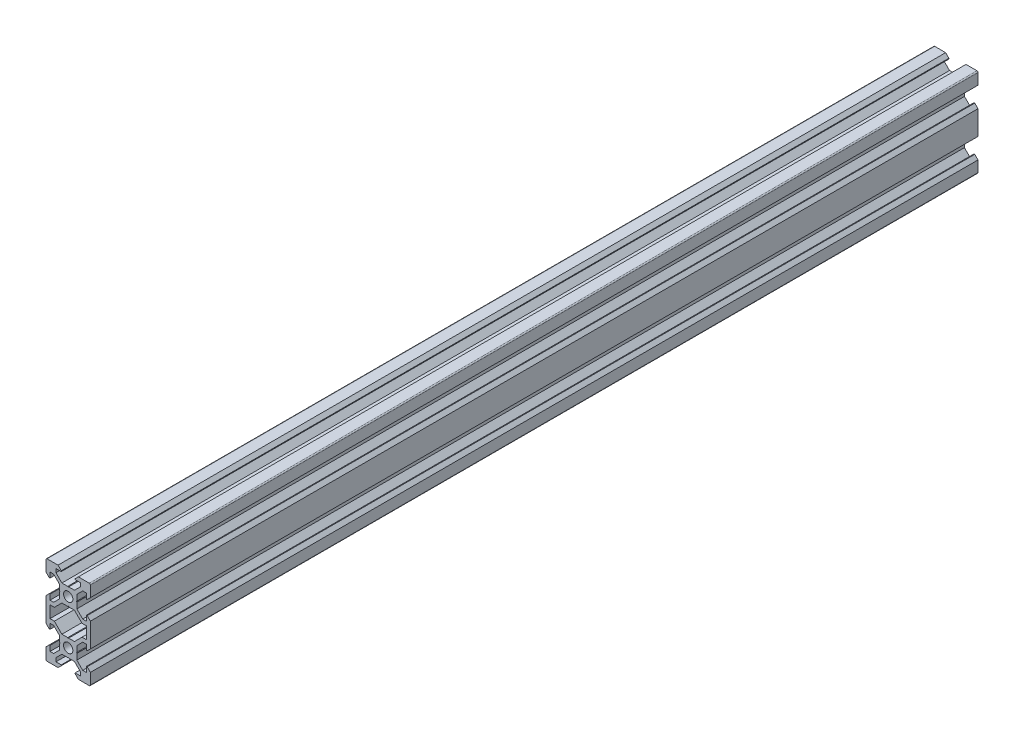
from build123d import *
from build123d.topology import SkipClean

# Parameters (mm, degrees)
BOSS_EXTRU_1_DEPTH     = 400
SYM_TRIE6_COPY_1_DEPTH = 400


with BuildPart() as part:
    # Esquisse1 → Boss.-Extru.1 (new body)
    with BuildSketch(Plane.XY):
        with BuildLine():
            Line((-9.5, 10), (-4.58, 10))
            Line((-4.58, 10), (-3.125, 8.545))
            Line((-3.125, 8.545), (-3.125, 8.2))
            Line((-3.125, 8.2), (-5.5, 8.2))
            Line((-5.5, 8.2), (-5.5, 6.560660172))
            Line((-5.5, 6.560660172), (-2.839339828, 3.9))
            Line((-2.839339828, 3.9), (-0.21, 3.9))
            Line((-0.21, 3.9), (0, 3.69))
            Line((0, 3.69), (0, 2.1))
            ThreePointArc((0, 2.1), (-2.1, 0), (0, -2.1))
            Line((0, -2.1), (0, -3.69))
            Line((0, -3.69), (-0.21, -3.9))
            Line((-0.21, -3.9), (-2.839339828, -3.9))
            Line((-2.839339828, -3.9), (-6.239339828, -7.3))
            Line((-6.239339828, -7.3), (-8.2, -7.3))
            Line((-8.2, -7.3), (-8.2, -10))
            Line((-8.2, -10), (-10, -10))
            Line((-10, -10), (-10, -4.58))
            Line((-10, -4.58), (-8.545, -3.125))
            Line((-8.545, -3.125), (-8.2, -3.125))
            Line((-8.2, -3.125), (-8.2, -5.5))
            Line((-8.2, -5.5), (-6.560660172, -5.5))
            Line((-6.560660172, -5.5), (-3.9, -2.839339828))
            Line((-3.9, -2.839339828), (-3.9, -0.21))
            Line((-3.9, -0.21), (-3.69, 0))
            Line((-3.69, 0), (-3.9, 0.21))
            Line((-3.9, 0.21), (-3.9, 2.839339828))
            Line((-3.9, 2.839339828), (-6.560660172, 5.5))
            Line((-6.560660172, 5.5), (-8.2, 5.5))
            Line((-8.2, 5.5), (-8.2, 3.125))
            Line((-8.2, 3.125), (-8.545, 3.125))
            Line((-8.545, 3.125), (-10, 4.58))
            Line((-10, 4.58), (-10, 9.5))
            ThreePointArc((-10, 9.5), (-9.853553391, 9.853553391), (-9.5, 10))
        make_face()
    boss_extru_1 = extrude(amount=BOSS_EXTRU_1_DEPTH)

    # Symétrie1: Boss.-Extru.1 across plane
    add(boss_extru_1.mirror(Plane(origin=(0, 3.69, 400), x_dir=(0, 0, 1), z_dir=(-1, 0, 0))))

    # Symétrie6: Boss.-Extru.1 across plane
    add(boss_extru_1.mirror(Plane(origin=(-8.2, -10, 400), x_dir=(0, 0, 1), z_dir=(0, 1, 0))))

    # Symétrie6 copy 1 sketch → Symétrie6 copy 1 (add)
    with SkipClean():  # the faces are left unmerged after this step: merging them gives an invalid solid
        with BuildSketch(Plane(origin=(0, -20, 0), x_dir=(-1, 0, 0), z_dir=(0, 0, 1))):
            with BuildLine():
                Line((-9.5, 10), (-4.58, 10))
                Line((-4.58, 10), (-3.125, 8.545))
                Line((-3.125, 8.545), (-3.125, 8.2))
                Line((-3.125, 8.2), (-5.5, 8.2))
                Line((-5.5, 8.2), (-5.5, 6.560660172))
                Line((-5.5, 6.560660172), (-2.839339828, 3.9))
                Line((-2.839339828, 3.9), (-0.21, 3.9))
                Line((-0.21, 3.9), (0, 3.69))
                Line((0, 3.69), (0, 2.1))
                ThreePointArc((0, 2.1), (-2.1, 0), (0, -2.1))
                Line((0, -2.1), (0, -3.69))
                Line((0, -3.69), (-0.21, -3.9))
                Line((-0.21, -3.9), (-2.839339828, -3.9))
                Line((-2.839339828, -3.9), (-6.239339828, -7.3))
                Line((-6.239339828, -7.3), (-8.2, -7.3))
                Line((-8.2, -7.3), (-8.2, -10))
                Line((-8.2, -10), (-10, -10))
                Line((-10, -10), (-10, -4.58))
                Line((-10, -4.58), (-8.545, -3.125))
                Line((-8.545, -3.125), (-8.2, -3.125))
                Line((-8.2, -3.125), (-8.2, -5.5))
                Line((-8.2, -5.5), (-6.560660172, -5.5))
                Line((-6.560660172, -5.5), (-3.9, -2.839339828))
                Line((-3.9, -2.839339828), (-3.9, -0.21))
                Line((-3.9, -0.21), (-3.69, 0))
                Line((-3.69, 0), (-3.9, 0.21))
                Line((-3.9, 0.21), (-3.9, 2.839339828))
                Line((-3.9, 2.839339828), (-6.560660172, 5.5))
                Line((-6.560660172, 5.5), (-8.2, 5.5))
                Line((-8.2, 5.5), (-8.2, 3.125))
                Line((-8.2, 3.125), (-8.545, 3.125))
                Line((-8.545, 3.125), (-10, 4.58))
                Line((-10, 4.58), (-10, 9.5))
                ThreePointArc((-10, 9.5), (-9.853553391, 9.853553391), (-9.5, 10))
            make_face()
        extrude(amount=SYM_TRIE6_COPY_1_DEPTH)


solid = part.part
